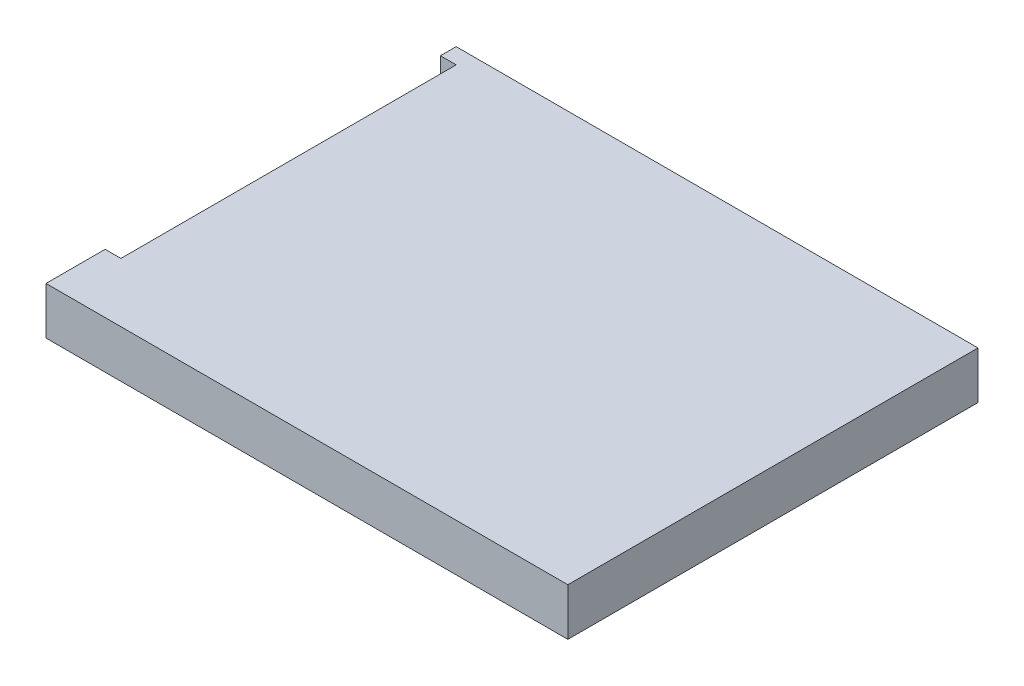
from build123d import *

# Parameters (mm, degrees)
SKETCH1_W           = 210.058
SKETCH1_H           = 165.1
BOSS_EXTRUDE1_DEPTH = 19.05
SKETCH2_W           = 6.35
SKETCH2_H           = 134.9502
CUT_EXTRUDE1_DEPTH  = 12.7


with BuildPart() as part:
    # Sketch1 → Boss-Extrude1 (new body)
    with BuildSketch(Plane(origin=(0, 0, 0), x_dir=(1, 0, 0), z_dir=(0, 1, 0))):
        with Locations((-3.036698363, -10.022289157)):
            Rectangle(SKETCH1_W, SKETCH1_H)
    extrude(amount=BOSS_EXTRUDE1_DEPTH)

    # Sketch2 → Cut-Extrude1 (cut)
    with BuildSketch(Plane(origin=(0, 19.05, 0), x_dir=(1, 0, 0), z_dir=(0, 1, 0))):
        with Locations((-104.890698363, -1.297389157)):
            Rectangle(SKETCH2_W, SKETCH2_H)
    extrude(amount=-CUT_EXTRUDE1_DEPTH, mode=Mode.SUBTRACT)


solid = part.part
